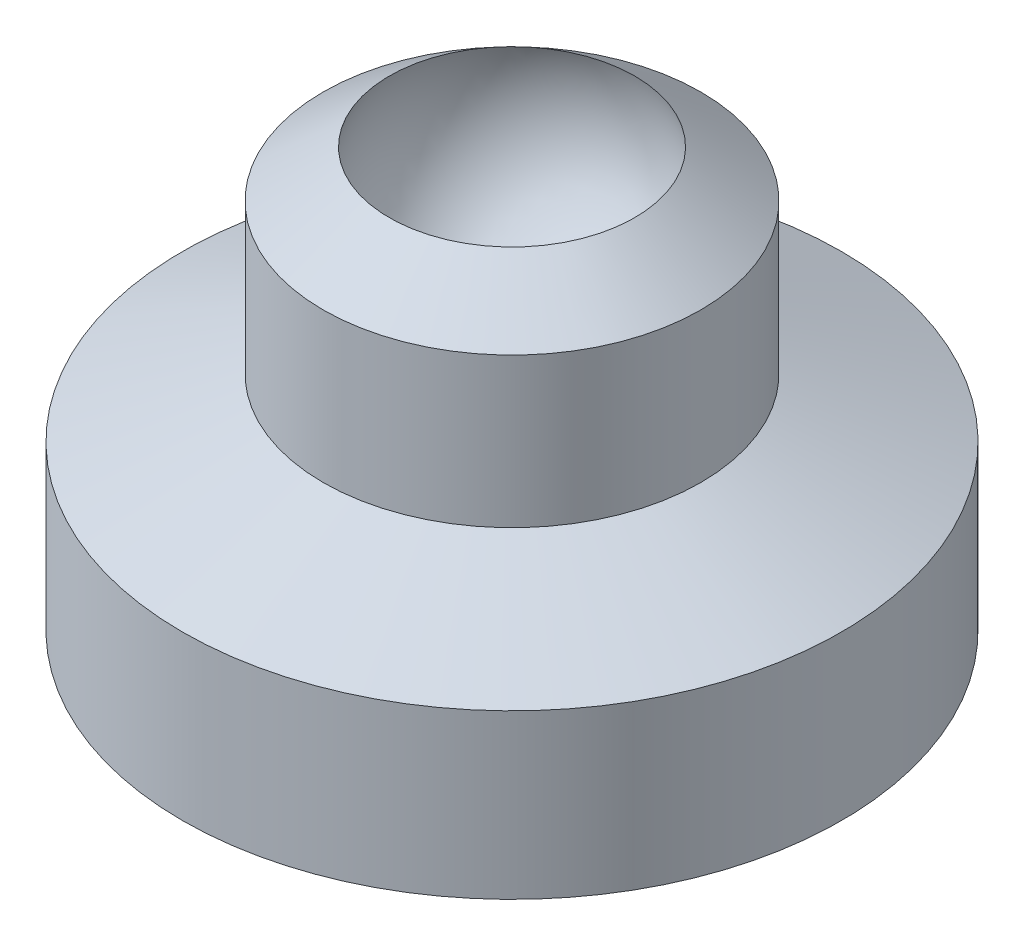
from build123d import *


with BuildPart() as part:
    # Sketch1 → Revolve1 (revolve)
    with BuildSketch(Plane(origin=(0, 0, 0), x_dir=(0, 0, -1), z_dir=(1, 0, 0)), mode=Mode.PRIVATE) as revolve1_sk:
        with BuildLine():
            Line((-345.479243, 0), (-395.31417, 0))
            Line((-395.31417, 0), (-395.31417, 24.696166))
            Line((-395.31417, 24.696166), (-374.03024, 33.626806))
            Line((-374.03024, 33.626806), (-374.03024, 56.232806))
            Line((-374.03024, 56.232806), (-364.03915, 63.317628))
            ThreePointArc((-364.03915, 63.317628), (-361.840984256, 44.965229789), (-345.479243, 36.366632473))
            Line((-345.479243, 36.366632473), (-345.479243, 0))
        make_face()
    revolve(revolve1_sk.sketch.rotate(Axis((0, 0, 345.479243), (0, 1, 0)), 180), axis=Axis((0, 0, 345.479243), (0, 1, 0)))


solid = part.part
